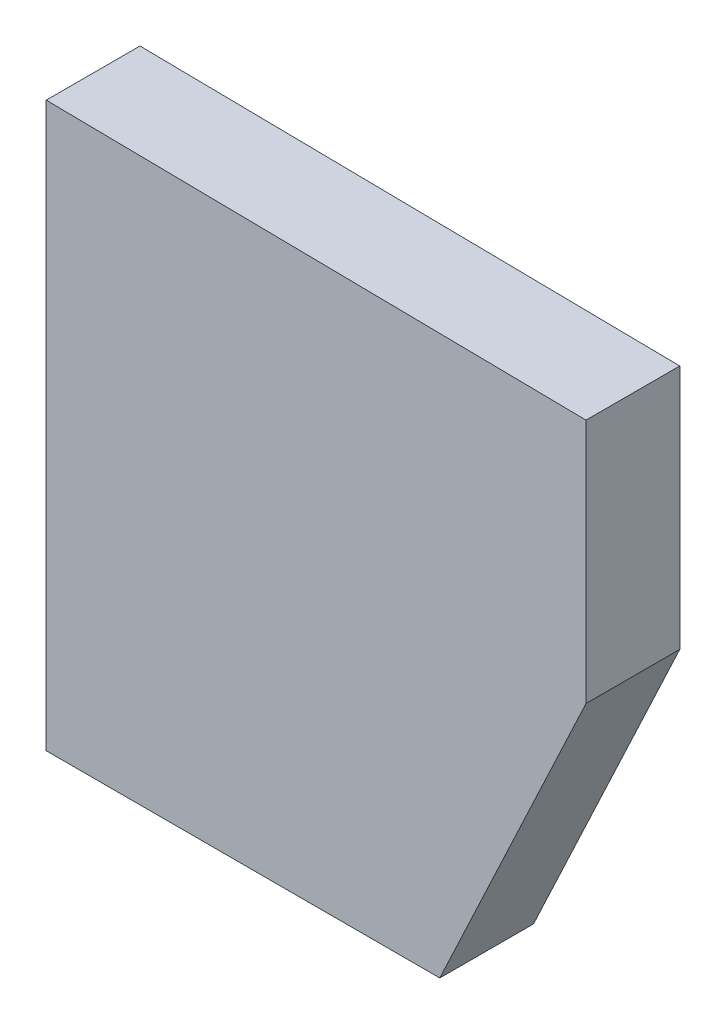
from build123d import *

# Parameters (mm, degrees)
BOSS_EXTRUDE1_DEPTH = 3
BOSS_EXTRUDE2_DEPTH = 16.5


with BuildPart() as part:
    # Sketch1 → Boss-Extrude1 (new body)
    with BuildSketch(Plane.XY):
        Polygon((0, 0), (91, -1.218180248), (91, -42), (66, -95.148154165), (0, -95.148154165), (0, -42), align=None)
    extrude(amount=BOSS_EXTRUDE1_DEPTH)

    # Sketch2 → Boss-Extrude2 (add)
    with BuildSketch(Plane.XY.offset(3)):
        Polygon((-2, -97.148154165), (67.269446555, -97.148154165), (93, -42.446897316), (93, 0.755225752), (-2, 2.026952385), align=None)
        Polygon((66, -95.148154165), (91, -42), (91, -1.218180248), (0, 0), (0, -95.148154165), align=None, mode=Mode.SUBTRACT)
    extrude(amount=-BOSS_EXTRUDE2_DEPTH)


solid = part.part
